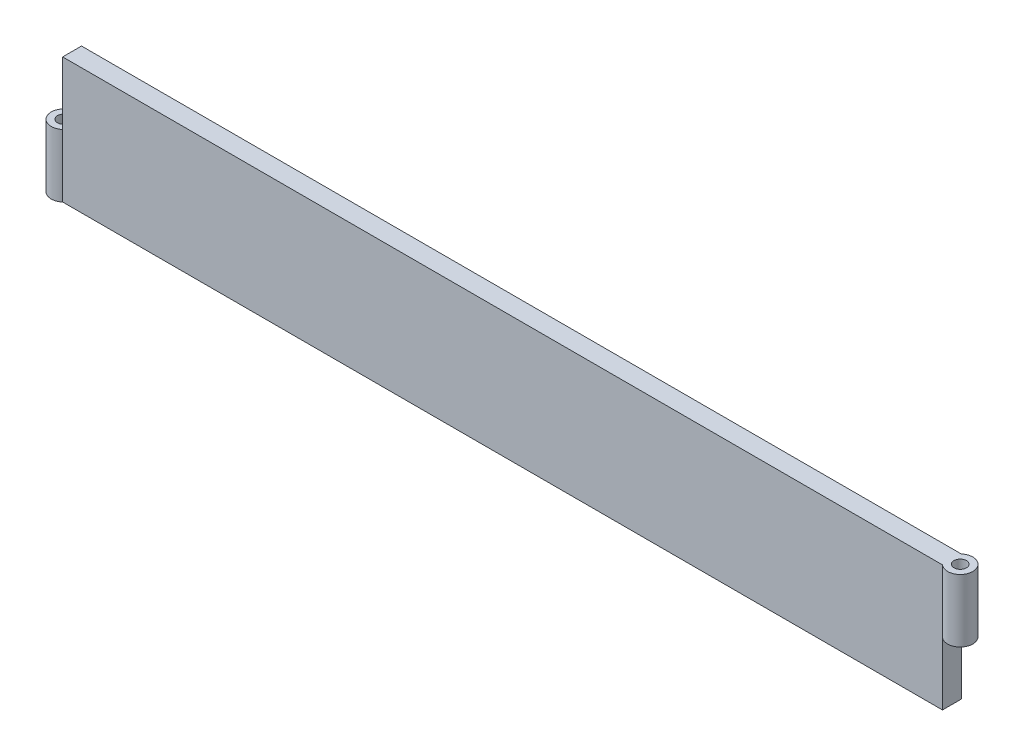
from build123d import *

# Parameters (mm, degrees)
SKETCH1_W           = 140
SKETCH1_H           = 20
BOSS_EXTRUDE1_DEPTH = 3
SKETCH2_R           = 2
SKETCH2_R_2         = 1
BOSS_EXTRUDE2_DEPTH = 10
SKETCH3_R           = 2
SKETCH3_R_2         = 1
BOSS_EXTRUDE3_DEPTH = 10


with BuildPart() as part:
    # Sketch1 → Boss-Extrude1 (new body)
    with BuildSketch(Plane.XY):
        with Locations((-25214.552845528, 8811.138211382)):
            Rectangle(SKETCH1_W, SKETCH1_H)
    extrude(amount=BOSS_EXTRUDE1_DEPTH)

    # Sketch2 → Boss-Extrude2 (add)
    with BuildSketch(Plane(origin=(0, 8821.138211382, 0), x_dir=(1, 0, 0), z_dir=(0, 1, 0))):
        with Locations((-25143.229969873, -1.5)):
            Circle(SKETCH2_R)
        with Locations(Location((-25143.229969873, -1.5, 0), (0, 0, 89.999999998))):
            Circle(SKETCH2_R_2, mode=Mode.SUBTRACT)
    extrude(amount=-BOSS_EXTRUDE2_DEPTH)

    # Sketch3 → Boss-Extrude3 (add)
    with BuildSketch(Plane.XZ.offset(-8801.138211382)):
        with Locations((-25285.875721184, 1.5)):
            Circle(SKETCH3_R)
        with Locations(Location((-25285.875721184, 1.5, 0), (0, 0, 270))):
            Circle(SKETCH3_R_2, mode=Mode.SUBTRACT)
    extrude(amount=-BOSS_EXTRUDE3_DEPTH)


solid = part.part
